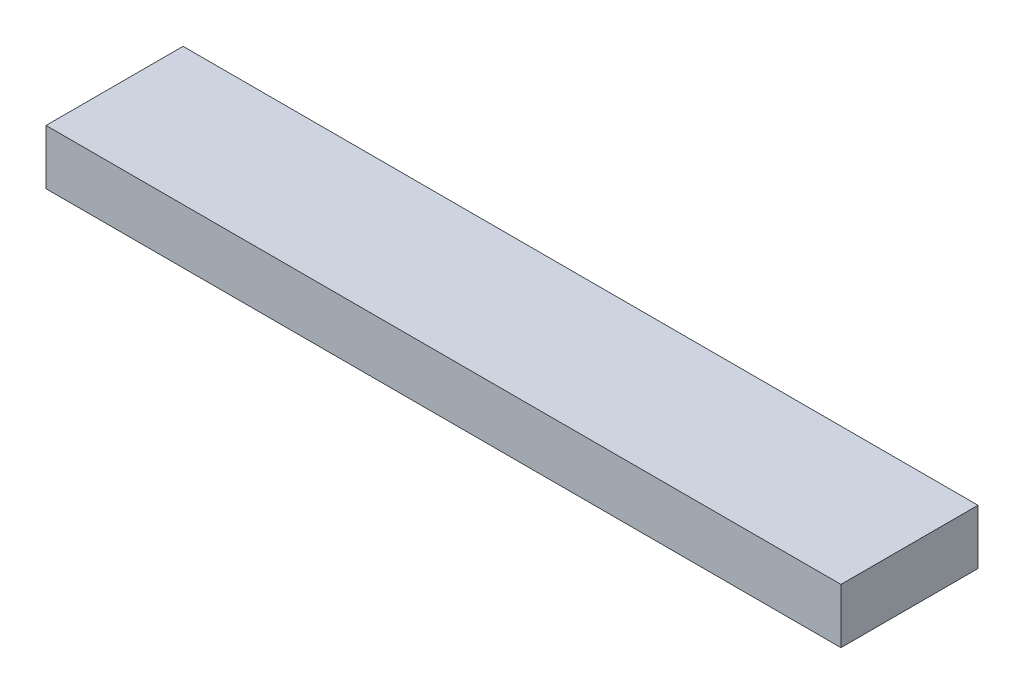
from build123d import *

# Parameters (mm, degrees)
SKETCH1_W           = 145
SKETCH1_H           = 25
BOSS_EXTRUDE1_DEPTH = 10


with BuildPart() as part:
    # Sketch1 → Boss-Extrude1 (new body)
    with BuildSketch(Plane(origin=(0, 0, 0), x_dir=(1, 0, 0), z_dir=(0, 1, 0))):
        with Locations((72.5, 12.5)):
            Rectangle(SKETCH1_W, SKETCH1_H)
    extrude(amount=BOSS_EXTRUDE1_DEPTH)


solid = part.part
